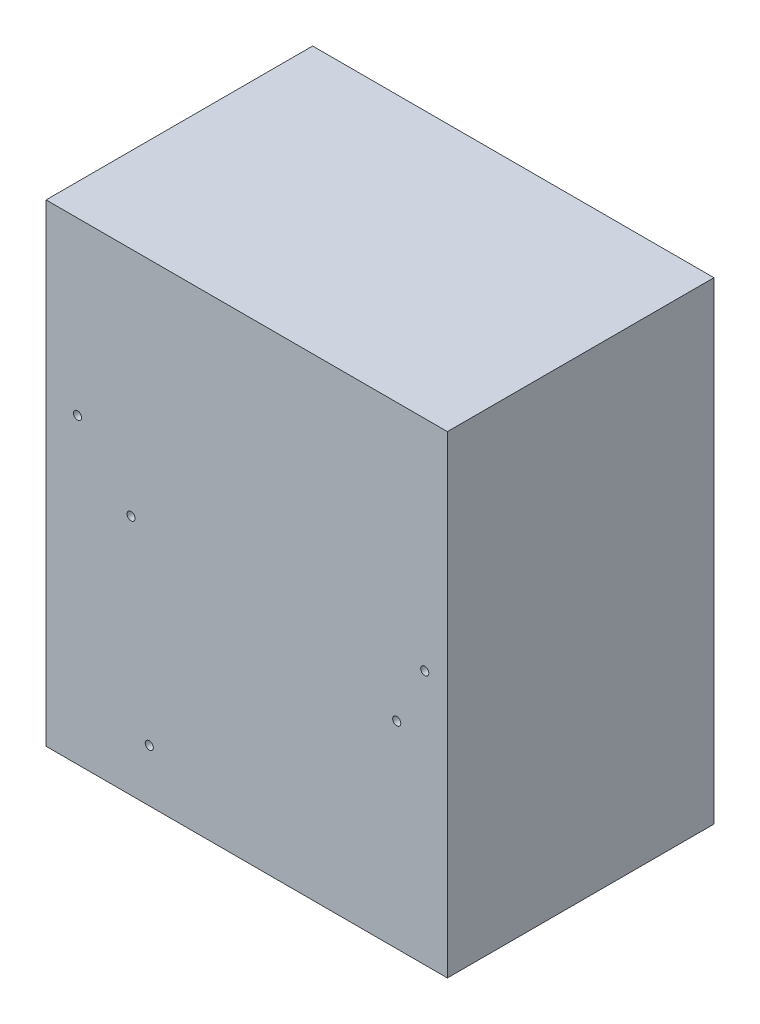
from build123d import *

# Parameters (mm, degrees)
SKELETON_W          = 134
SKELETON_H          = 158
SKELETON_R          = 1.35
BOSS_EXTRUDE1_DEPTH = 4
BOSS_EXTRUDE2_START = -85
BOSS_EXTRUDE2_DEPTH = 85


with BuildPart() as part:
    # SKELETON → Boss-Extrude1 (new body)
    with BuildSketch(Plane.XY):
        with Locations((67, 75)):
            Rectangle(SKELETON_W, SKELETON_H)
        with Locations((28.381789687, 76.742237148)):
            Circle(SKELETON_R, mode=Mode.SUBTRACT)
        with Locations((10.500607165, 96.922428852)):
            Circle(SKELETON_R, mode=Mode.SUBTRACT)
        with Locations((126.445833013, 81.02799961)):
            Circle(SKELETON_R, mode=Mode.SUBTRACT)
        with Locations((34.46465583, 13.502410031)):
            Circle(SKELETON_R, mode=Mode.SUBTRACT)
        with Locations((117.09085583, 61.838610031)):
            Circle(SKELETON_R, mode=Mode.SUBTRACT)
    extrude(amount=BOSS_EXTRUDE1_DEPTH)

    # SKELETON<3> → Boss-Extrude2 (add)
    with BuildSketch(Plane.XY.offset(BOSS_EXTRUDE2_START)):
        Polygon((134, 154), (0, 154), (0, 150), (130, 150), (130, 0), (0, 0), (0, -4), (134, -4), align=None)
    extrude(amount=BOSS_EXTRUDE2_DEPTH)


solid = part.part
